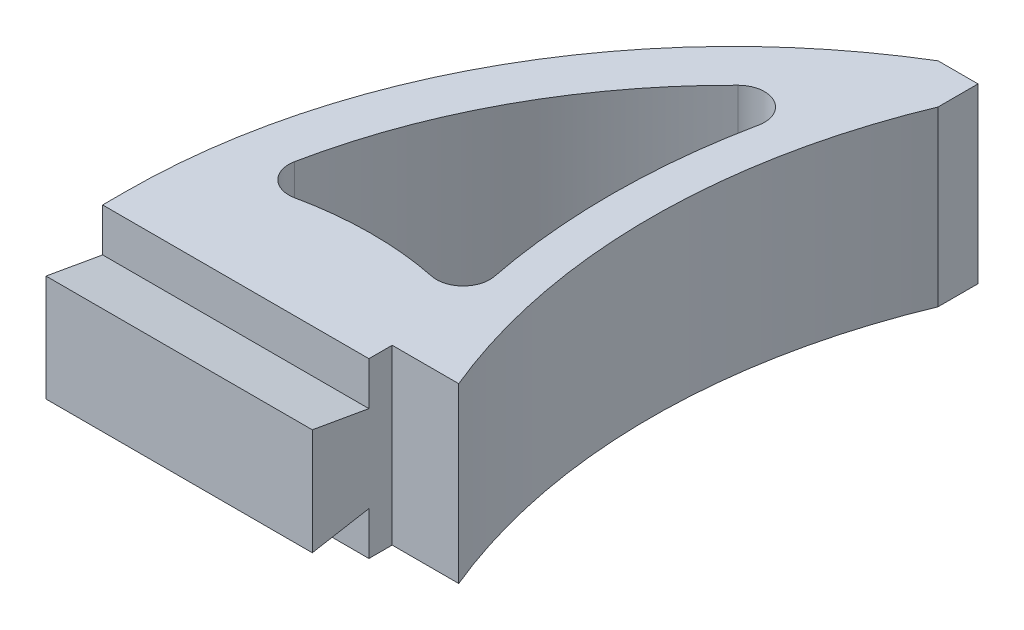
from build123d import *

# Parameters (mm, degrees)
EXTRUDE_1_DEPTH     = 13
CUT_EXTRUDE_1_DEPTH = 49.114446895


with BuildPart() as part:
    # 草图1 → 凸台-拉伸1 (new body)
    with BuildSketch(Plane(origin=(0, 0, 0), x_dir=(1, 0, 0), z_dir=(0, 1, 0))):
        with BuildLine():
            Line((20, 0), (25, 0))
            ThreePointArc((25, 0), (21.416586692, 18), (25, 36))
            Line((25, 36), (25, 39))
            Line((25, 39), (22, 39))
            ThreePointArc((22, 39), (5.87927664, 22.388613177), (0, 0))
            Line((0, 0), (0, -6))
            Line((0, -6), (20, -6))
            Line((20, -6), (20, 0))
        make_face()
        with BuildLine():
            ThreePointArc((16.080059058, 29.907367254), (8.618420181, 19.967852036), (4.392399403, 8.279791209))
            ThreePointArc((4.392399403, 8.279791209), (4.947419472, 6.462870357), (6.770848151, 5.929619467))
            ThreePointArc((6.770848151, 5.929619467), (11.882919882, 6.480681597), (16.999608279, 5.974275931))
            ThreePointArc((16.999608279, 5.974275931), (18.809570487, 6.514692506), (19.362380146, 8.320908094))
            ThreePointArc((19.362380146, 8.320908094), (18.417004852, 18.204489029), (19.4431912, 28.080006643))
            ThreePointArc((19.4431912, 28.080006643), (18.439109127, 30.240549881), (16.080059058, 29.907367254))
        make_face(mode=Mode.SUBTRACT)
    extrude(amount=EXTRUDE_1_DEPTH)

    # 草图2 → 切除-拉伸1 (cut, through all)
    with BuildSketch(Plane.ZY):
        Polygon((1.746538635, 13), (1.746538635, 9.75), (6, 10.5), (6, 13), align=None)
        Polygon((6, 2.5), (6, 0), (1.746538635, 0), (1.746538635, 3.25), align=None)
    extrude(amount=-CUT_EXTRUDE_1_DEPTH, mode=Mode.SUBTRACT)


solid = part.part
